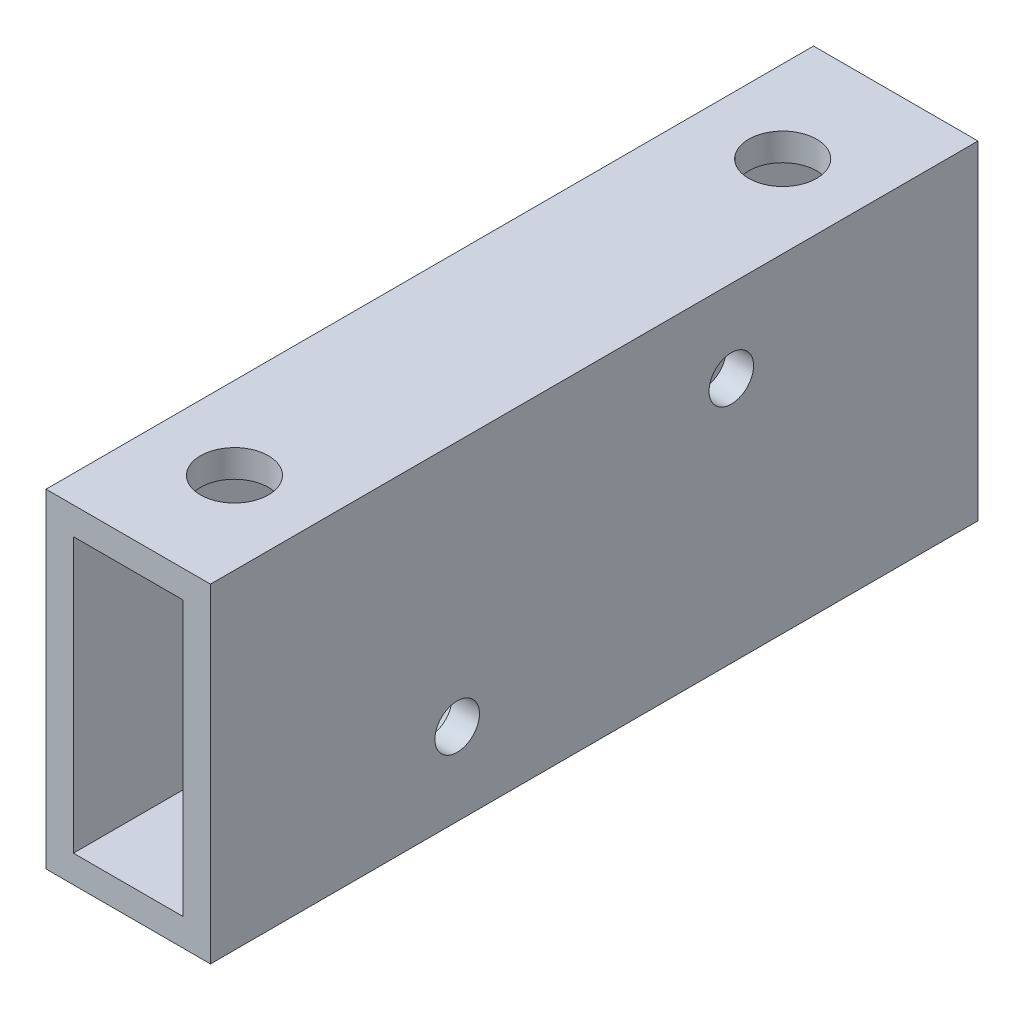
from build123d import *

# Parameters (mm, degrees)
SKETCH1_W           = 19.05
SKETCH1_H           = 38.1
SKETCH1_W_2         = 12.7
SKETCH1_H_2         = 31.75
BOSS_EXTRUDE1_DEPTH = 88.9
SKETCH2_R           = 2.778125
CUT_EXTRUDE1_DEPTH  = 98.188196943
CUT_EXTRUDE2_REACH  = 99.188
SKETCH3_R           = 3.937
CUT_EXTRUDE3_REACH  = 94.892
SKETCH4_R           = 2.5796875


with BuildPart() as part:
    # Sketch1 → Boss-Extrude1 (new body)
    with BuildSketch(Plane.XY):
        Rectangle(SKETCH1_W, SKETCH1_H)
        Rectangle(SKETCH1_W_2, SKETCH1_H_2, mode=Mode.SUBTRACT)
    extrude(amount=BOSS_EXTRUDE1_DEPTH)

    # Sketch2 → Cut-Extrude1 (cut, through all)
    with BuildSketch(Plane(origin=(0, 19.05, 0), x_dir=(1, 0, 0), z_dir=(0, 1, 0))):
        with Locations(Location((0, -76.596875, 0), (0, 0, 270))):
            Circle(SKETCH2_R)
        with Locations(Location((0, -13.096875, 0), (0, 0, 270))):
            Circle(SKETCH2_R)
    extrude(amount=-CUT_EXTRUDE1_DEPTH, mode=Mode.SUBTRACT)

    # Sketch3 → Cut-Extrude2 (cut, up to next)
    with BuildSketch(Plane(origin=(0, 19.05, 0), x_dir=(1, 0, 0), z_dir=(0, 1, 0)), mode=Mode.PRIVATE) as cut_extrude2_sk1:
        with Locations(Location((0, -76.596875, 0), (0, 0, 270))):
            Circle(SKETCH3_R)
    cut_extrude2_tool1 = extrude(cut_extrude2_sk1.sketch, amount=-CUT_EXTRUDE2_REACH, mode=Mode.PRIVATE) & part.part
    # Sketch3 → Cut-Extrude2 (cut, up to next)
    with BuildSketch(Plane(origin=(0, 19.05, 0), x_dir=(1, 0, 0), z_dir=(0, 1, 0)), mode=Mode.PRIVATE) as cut_extrude2_sk2:
        with Locations(Location((0, -13.096875, 0), (0, 0, 270))):
            Circle(SKETCH3_R)
    cut_extrude2_tool2 = extrude(cut_extrude2_sk2.sketch, amount=-CUT_EXTRUDE2_REACH, mode=Mode.PRIVATE) & part.part
    add(cut_extrude2_tool1.solids().sort_by_distance((0, 19.05, 76.596875))[0], mode=Mode.SUBTRACT)
    add(cut_extrude2_tool2.solids().sort_by_distance((0, 19.05, 13.096875))[0], mode=Mode.SUBTRACT)

    # Sketch4 → Cut-Extrude3 (cut, up to next)
    with BuildSketch(Plane(origin=(9.525, 0, 0), x_dir=(0, 0, -1), z_dir=(1, 0, 0)), mode=Mode.PRIVATE) as cut_extrude3_sk1:
        with Locations((-60.325, -9.525)):
            Circle(SKETCH4_R)
    cut_extrude3_tool1 = extrude(cut_extrude3_sk1.sketch, amount=-CUT_EXTRUDE3_REACH, mode=Mode.PRIVATE) & part.part
    # Sketch4 → Cut-Extrude3 (cut, up to next)
    with BuildSketch(Plane(origin=(9.525, 0, 0), x_dir=(0, 0, -1), z_dir=(1, 0, 0)), mode=Mode.PRIVATE) as cut_extrude3_sk2:
        with Locations((-28.575, 9.525)):
            Circle(SKETCH4_R)
    cut_extrude3_tool2 = extrude(cut_extrude3_sk2.sketch, amount=-CUT_EXTRUDE3_REACH, mode=Mode.PRIVATE) & part.part
    add(cut_extrude3_tool1.solids().sort_by_distance((9.525, -9.525, 60.325))[0], mode=Mode.SUBTRACT)
    add(cut_extrude3_tool2.solids().sort_by_distance((9.525, 9.525, 28.575))[0], mode=Mode.SUBTRACT)


solid = part.part
